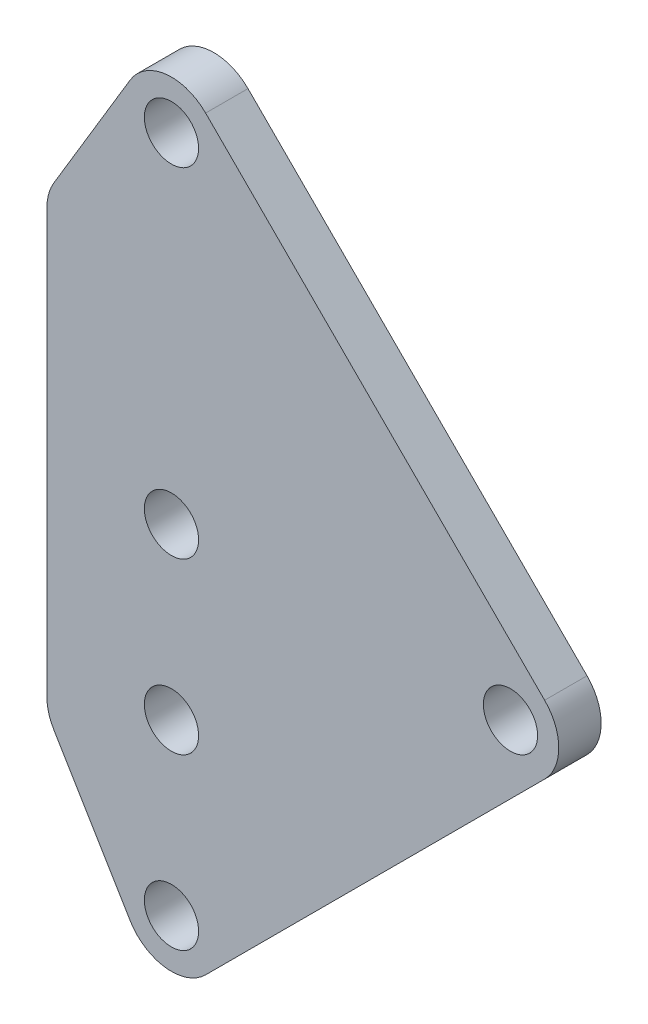
from build123d import *

# Parameters (mm, degrees)
SKETCH1_R           = 2.032
BOSS_EXTRUDE1_DEPTH = 3.175


with BuildPart() as part:
    # Sketch1 → Boss-Extrude1 (new body)
    with BuildSketch(Plane.XY):
        with BuildLine():
            Line((2.559372995, 27.959372995), (27.959372995, 2.559372995))
            ThreePointArc((27.959372995, 2.559372995), (29.0195, 0), (27.959372995, -2.559372995))
            Line((27.959372995, -2.559372995), (2.559372995, -27.959372995))
            ThreePointArc((2.559372995, -27.959372995), (-0.442722203, -28.992321993), (-3.104193058, -27.261388113))
            Line((-3.104193058, -27.261388113), (-8.815732721, -17.736388113))
            ThreePointArc((-8.815732721, -17.736388113), (-9.199834878, -16.840700128), (-9.331039662, -15.875))
            Line((-9.331039662, -15.875), (-9.331039662, 15.875))
            ThreePointArc((-9.331039662, 15.875), (-9.199834878, 16.840700128), (-8.815732721, 17.736388113))
            Line((-8.815732721, 17.736388113), (-3.104193058, 27.261388113))
            ThreePointArc((-3.104193058, 27.261388113), (-0.442722203, 28.992321993), (2.559372995, 27.959372995))
        make_face()
        Circle(SKETCH1_R, mode=Mode.SUBTRACT)
        with Locations((0, 25.4)):
            Circle(SKETCH1_R, mode=Mode.SUBTRACT)
        with Locations((0, -25.4)):
            Circle(SKETCH1_R, mode=Mode.SUBTRACT)
        with Locations((25.4, 0)):
            Circle(SKETCH1_R, mode=Mode.SUBTRACT)
        with Locations((0, -12.7)):
            Circle(SKETCH1_R, mode=Mode.SUBTRACT)
    extrude(amount=BOSS_EXTRUDE1_DEPTH)


solid = part.part
